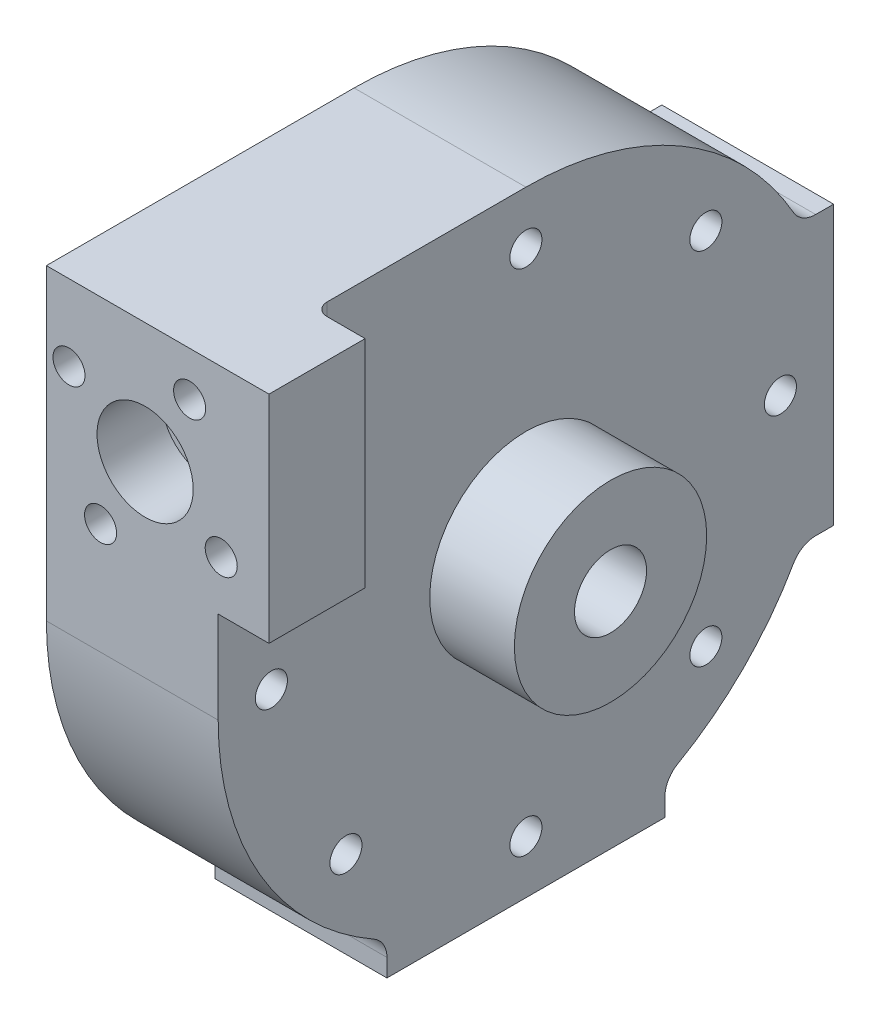
from build123d import *

# Parameters (mm, degrees)
HOUSING_2_DEPTH          = 44.45
SKETCH2_R                = 43.815
IMPELLER_CUT_DEPTH       = 22.4028
SKETCH4_R                = 4.826
INLET_CUT_DEPTH          = 19.8628
SKETCH6_R                = 3.175
FASTENER_BORE_DEPTH      = 116.84
FASTENER_PATTERN_COUNT   = 8
SKETCH7_R                = 100.114274451
SKETCH7_R_2              = 19.05
MASS_REDUCTION_CUT_DEPTH = 10.414
SKETCH11_R               = 19.05
SKETCH11_R_2             = 4.826
BOSS_EXTRUDE1_DEPTH      = 6.35
SKETCH14_R               = 2.38125
CUT_EXTRUDE3_DEPTH       = 99.06
SKETCH15_R               = 9.525
CUT_EXTRUDE4_DEPTH       = 25.4
BOSS_EXTRUDE2_START      = 12.7
SKETCH16_R               = 9.525
SKETCH16_R_2             = 6.35
BOSS_EXTRUDE2_DEPTH      = 12.7
SKETCH18_W               = 10.060456949
SKETCH18_H               = 42.763815868
BOSS_EXTRUDE3_DEPTH      = 19.05
FILLET7_R                = 2.54
SKETCH19_R               = 3.175
CUT_EXTRUDE5_DEPTH       = 15.24
FILLET9_R                = 5.08
SKETCH22_R               = 7.1374
CUT_EXTRUDE8_DEPTH       = 17.78
CIRPATTERN2_COUNT        = 4


with BuildPart() as part:
    # Sketch1 → Housing 2 (new body)
    with BuildSketch(Plane(origin=(0, 0, 0), x_dir=(0, 0, -1), z_dir=(1, 0, 0))):
        with BuildLine():
            Line((-60.96, 0), (-60.96, 60.96))
            Line((-60.96, 60.96), (0, 60.96))
            ThreePointArc((0, 60.96), (31.907091375, 51.942844743), (54.374839025, 27.559))
            Line((54.374839025, 27.559), (60.96, 27.559))
            Line((60.96, 27.559), (60.96, -27.559))
            Line((60.96, -27.559), (54.374839025, -27.559))
            ThreePointArc((54.374839025, -27.559), (43.093739421, -43.116716279), (27.530012063, -54.389521379))
            Line((27.530012063, -54.389521379), (27.530012063, -60.96))
            Line((27.530012063, -60.96), (-27.530012063, -60.96))
            Line((-27.530012063, -60.96), (-27.530012063, -54.389521379))
            ThreePointArc((-27.530012063, -54.389521379), (-51.934339003, -31.920934077), (-60.96, 0))
        make_face()
    extrude(amount=HOUSING_2_DEPTH)

    # Sketch2 → Impeller Cut (cut)
    with BuildSketch(Plane.ZY):
        Circle(SKETCH2_R)
    extrude(amount=-IMPELLER_CUT_DEPTH, mode=Mode.SUBTRACT)

    # Sketch3 → Impeller Angle Cut (revolve, cut)
    with BuildSketch(Plane.XY, mode=Mode.PRIVATE) as impeller_angle_cut_sk:
        Polygon((29.602825054, 9.641475923), (22.4028, 43.815), (22.225, 0), (29.602825054, 0), align=None)
    revolve(impeller_angle_cut_sk.sketch.rotate(Axis((22.225, 0, 0), (1, 0, 0)), 180), axis=Axis((22.225, 0, 0), (1, 0, 0)), mode=Mode.SUBTRACT)

    # Sketch4 → Inlet Cut (cut)
    with BuildSketch(Plane.ZY.offset(-29.602825054)):
        Circle(SKETCH4_R)
    extrude(amount=-INLET_CUT_DEPTH, mode=Mode.SUBTRACT)

    # Sketch6 → Fastener Bore (cut)
    with BuildSketch(Plane(origin=(44.45, 0, 0), x_dir=(0, 0, -1), z_dir=(1, 0, 0))):
        with Locations((50.419, 0)):
            Circle(SKETCH6_R)
    fastener_bore = extrude(amount=-FASTENER_BORE_DEPTH, mode=Mode.SUBTRACT)

    # Fastener Pattern: Fastener Bore ×8 about axis, 1 skipped
    fastener_pattern_axis = Axis((0, 0, 0), (-1, 0, 0))
    add([fastener_bore.rotate(fastener_pattern_axis, i * 360 / FASTENER_PATTERN_COUNT) for i in range(1, FASTENER_PATTERN_COUNT) if i not in (5,)], mode=Mode.SUBTRACT)

    # Sketch7 → Mass Reduction Cut (cut)
    with BuildSketch(Plane(origin=(44.45, 0, 0), x_dir=(0, 0, -1), z_dir=(1, 0, 0))):
        Circle(SKETCH7_R)
        Circle(SKETCH7_R_2, mode=Mode.SUBTRACT)
    extrude(amount=-MASS_REDUCTION_CUT_DEPTH, mode=Mode.SUBTRACT)

    # Sketch11 → Boss-Extrude1 (add)
    with BuildSketch(Plane(origin=(44.45, 0, 0), x_dir=(0, 0, -1), z_dir=(1, 0, 0))):
        Circle(SKETCH11_R)
        with Locations(Location((0, 0, 0), (0, 0, 180))):
            Circle(SKETCH11_R_2, mode=Mode.SUBTRACT)
    extrude(amount=BOSS_EXTRUDE1_DEPTH)

    # Sketch14 → Cut-Extrude3 (cut)
    with BuildSketch(Plane.XY):
        with Locations(Location((19.558, 37.084, 0), (0, 0, 180))):
            Circle(SKETCH14_R)
    extrude(amount=CUT_EXTRUDE3_DEPTH, mode=Mode.SUBTRACT)

    # Sketch15 → Cut-Extrude4 (cut)
    with BuildSketch(Plane.XY.offset(60.96)):
        with Locations((19.558, 37.084)):
            Circle(SKETCH15_R)
    extrude(amount=-CUT_EXTRUDE4_DEPTH, mode=Mode.SUBTRACT)

    # Sketch16 → Boss-Extrude2 (add)
    with BuildSketch(Plane.XY.offset(35.56).offset(BOSS_EXTRUDE2_START)):
        with Locations((19.558, 37.084)):
            Circle(SKETCH16_R)
        with Locations(Location((19.558, 37.084, 0), (0, 0, 180))):
            Circle(SKETCH16_R_2, mode=Mode.SUBTRACT)
    extrude(amount=-BOSS_EXTRUDE2_DEPTH)

    # Sketch18 → Boss-Extrude3 (add)
    with BuildSketch(Plane.XY.offset(60.96)):
        with Locations((39.066228475, 39.578092066)):
            Rectangle(SKETCH18_W, SKETCH18_H)
    extrude(amount=-BOSS_EXTRUDE3_DEPTH)

    # Fillet7
    fillet7_edges = [part.edges().sort_by_distance(p)[0] for p in [
        (34.036, 39.578092066, 41.91),
    ]]
    fillet(fillet7_edges, radius=FILLET7_R)

    # Sketch19 → Cut-Extrude5 (cut)
    with BuildSketch(Plane.XY.offset(60.96)):
        with Locations((34.640612035, 28.263568969)):
            Circle(SKETCH19_R)
    cut_extrude5 = extrude(amount=-CUT_EXTRUDE5_DEPTH, mode=Mode.SUBTRACT)

    # Fillet9
    fillet9_edges = [part.edges().sort_by_distance(p)[0] for p in [
        (17.018, 27.559, -54.374839025),
        (17.018, -27.559, -54.374839025),
        (17.018, -54.389521379, -27.530012063),
        (17.018, -54.389521379, 27.530012063),
    ]]
    fillet(fillet9_edges, radius=FILLET9_R)

    # Sketch22 → Cut-Extrude8 (cut)
    with BuildSketch(Plane(origin=(50.8, 0, 0), x_dir=(0, 0, -1), z_dir=(1, 0, 0))):
        Circle(SKETCH22_R)
    extrude(amount=-CUT_EXTRUDE8_DEPTH, mode=Mode.SUBTRACT)

    # CirPattern2: Cut-Extrude5 ×4 about axis
    cirpattern2_axis = Axis((19.558, 37.084, 0), (0, 0, 1))
    for i in range(1, CIRPATTERN2_COUNT):
        add(cut_extrude5.rotate(cirpattern2_axis, i * 360 / CIRPATTERN2_COUNT), mode=Mode.SUBTRACT)


solid = part.part
